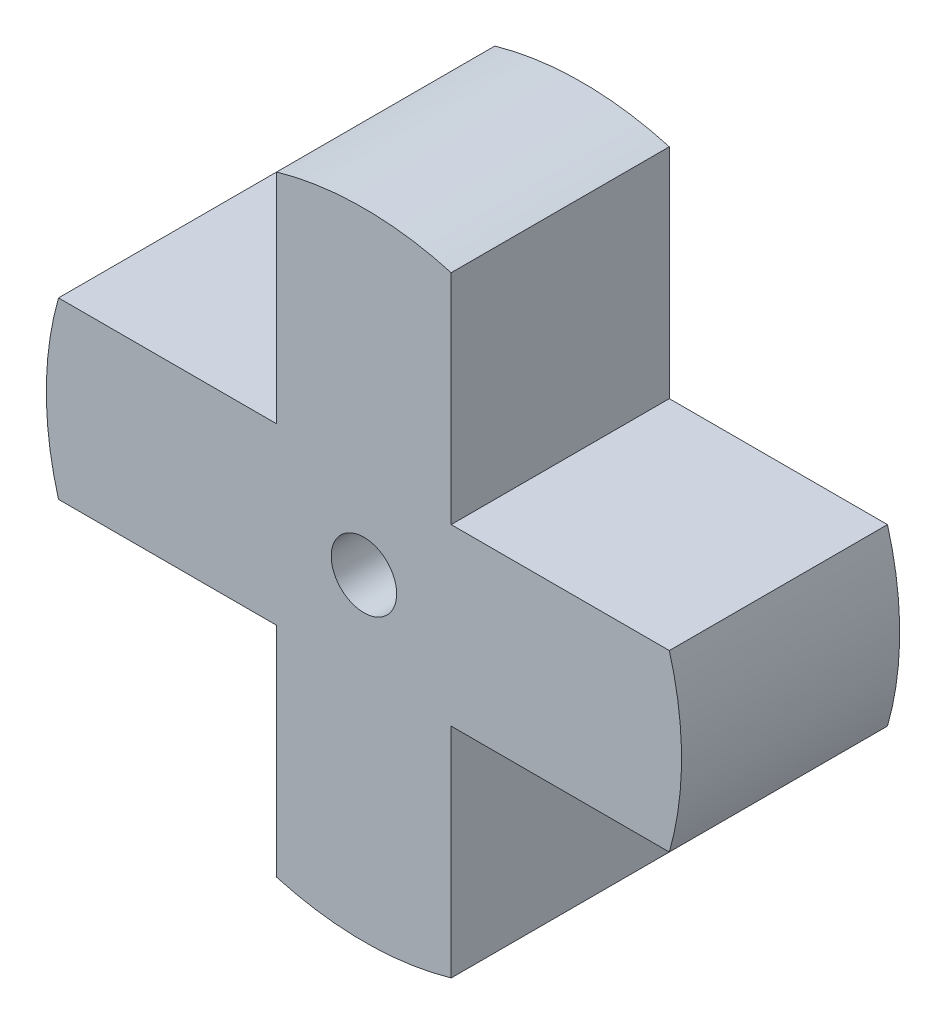
from build123d import *

# Parameters (mm, degrees)
SKETCH1_R           = 0.75
BOSS_EXTRUDE1_DEPTH = 5


with BuildPart() as part:
    # Sketch1 → Boss-Extrude1 (new body)
    # profile 1 of 5: a face of its own
    with BuildSketch(Plane.XY):
        with BuildLine():
            Line((-7, -2), (-2, -2))
            Line((-2, -2), (-2, 0))
            Line((-2, 0), (-2, 2))
            Line((-2, 2), (-7, 2))
            ThreePointArc((-7, 2), (-7.280109889, 0), (-7, -2))
        make_face()
    # profile 2 of 5: a face of its own
    with BuildSketch(Plane.XY):
        with BuildLine():
            Line((0, 2), (2, 2))
            Line((2, 2), (2, 7))
            ThreePointArc((2, 7), (0, 7.280109889), (-2, 7))
            Line((-2, 7), (-2, 2))
            Line((-2, 2), (0, 2))
        make_face()
    # profile 3 of 5: a face of its own
    with BuildSketch(Plane.XY):
        Polygon((-2, -2), (0, -2), (2, -2), (2, 0), (2, 2), (0, 2), (-2, 2), (-2, 0), align=None)
        Circle(SKETCH1_R, mode=Mode.SUBTRACT)
    # profile 4 of 5: a face of its own
    with BuildSketch(Plane.XY):
        with BuildLine():
            Line((2, -2), (0, -2))
            Line((0, -2), (-2, -2))
            Line((-2, -2), (-2, -7))
            ThreePointArc((-2, -7), (0, -7.280109889), (2, -7))
            Line((2, -7), (2, -2))
        make_face()
    # profile 5 of 5: a face of its own
    with BuildSketch(Plane.XY):
        with BuildLine():
            Line((2, 0), (2, -2))
            Line((2, -2), (7, -2))
            ThreePointArc((7, -2), (7.20974234, -1.009760064), (7.280109889, 0))
            ThreePointArc((7.280109889, 0), (7.20974234, 1.009760064), (7, 2))
            Line((7, 2), (2, 2))
            Line((2, 2), (2, 0))
        make_face()
    extrude(amount=BOSS_EXTRUDE1_DEPTH)


solid = part.part
